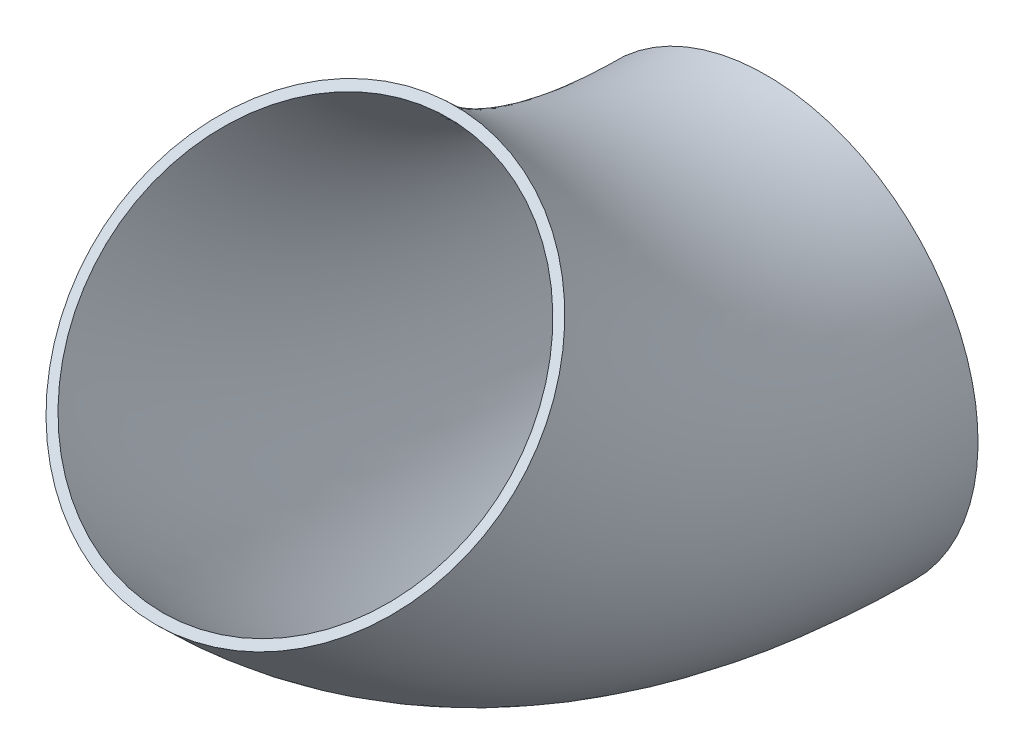
from build123d import *

# Parameters (mm, degrees)
ESQUISSE1_R   = 32.5
ESQUISSE1_R_2 = 31


with BuildPart() as part:
    # Balayage5: sweep along a path in Esquisse2
    with BuildLine(Plane(origin=(0, 0, 0), x_dir=(0, 0, -1), z_dir=(1, 0, 0))) as balayage5_path:
        ThreePointArc((0, 0), (-38.268343237, 7.612046749), (-70.710678119, 29.289321881))
    # Esquisse1 → Balayage5 (sweep)
    with BuildSketch(Plane.XY):
        Circle(ESQUISSE1_R)
        Circle(ESQUISSE1_R_2, mode=Mode.SUBTRACT)
    sweep(path=balayage5_path.line)


solid = part.part
